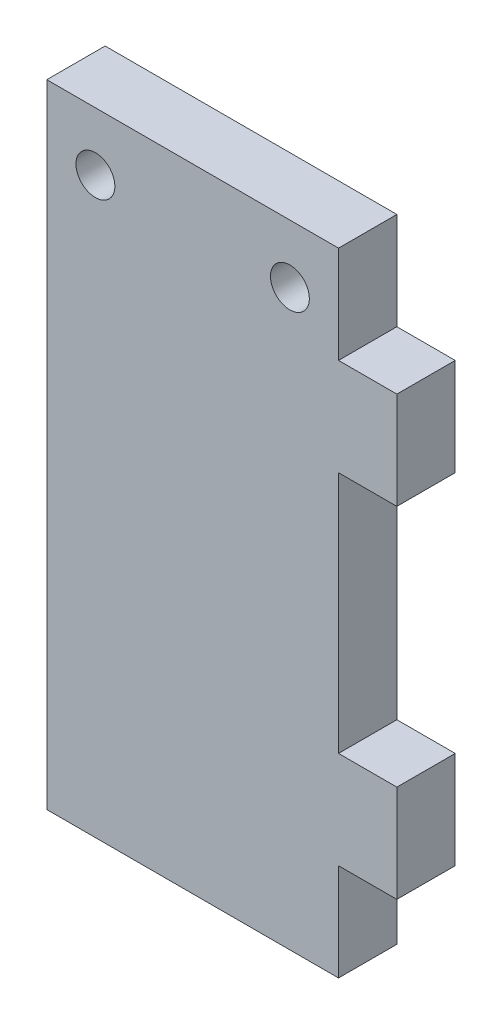
from build123d import *

# Parameters (mm, degrees)
ESQUISSE1_W             = 30
ESQUISSE1_H             = 65
BOSS_EXTRU_1_DEPTH      = 6
ESQUISSE2_W             = 6
ESQUISSE2_H             = 10
BOSS_EXTRU_3_DEPTH      = 6
ESQUISSE3_R             = 2
ENL_V_MAT_EXTRU_1_DEPTH = 6


with BuildPart() as part:
    # Esquisse1 → Boss.-Extru.1 (new body)
    with BuildSketch(Plane.XY):
        with Locations((-15, 32.5)):
            Rectangle(ESQUISSE1_W, ESQUISSE1_H)
    extrude(amount=BOSS_EXTRU_1_DEPTH)

    # Esquisse2 → Boss.-Extru.3 (add)
    with BuildSketch(Plane(origin=(0, 0, 0), x_dir=(0, 0, -1), z_dir=(1, 0, 0))):
        with Locations((-3, 15)):
            Rectangle(ESQUISSE2_W, ESQUISSE2_H)
        with Locations((-3, 50)):
            Rectangle(ESQUISSE2_W, ESQUISSE2_H)
    extrude(amount=BOSS_EXTRU_3_DEPTH)

    # Esquisse3 → Enlèv. mat.-Extru.1 (cut)
    with BuildSketch(Plane.XY.offset(6)):
        with Locations((-25, 59)):
            Circle(ESQUISSE3_R)
        with Locations((-5, 59)):
            Circle(ESQUISSE3_R)
    extrude(amount=-ENL_V_MAT_EXTRU_1_DEPTH, mode=Mode.SUBTRACT)


solid = part.part
